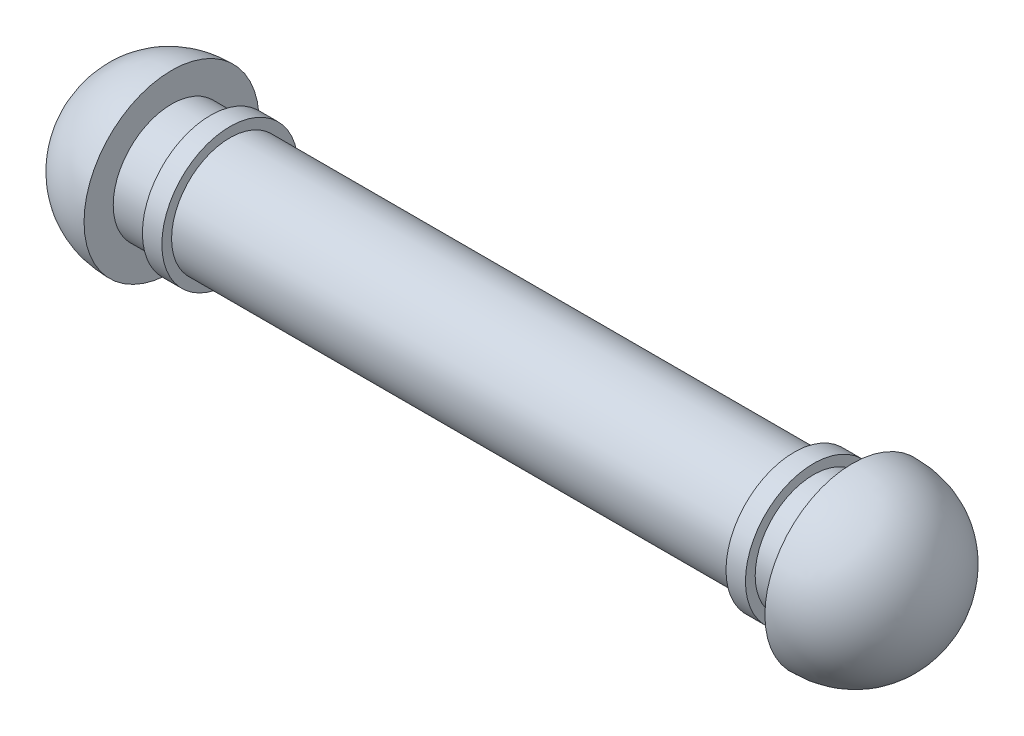
from build123d import *

# Parameters (mm, degrees)
SKETCH1_R           = 30
BOSS_EXTRUDE1_DEPTH = 175
SKETCH3_W           = 10
SKETCH3_H           = 35


with BuildPart() as part:
    # Sketch1 → Boss-Extrude1 (new body)
    with BuildSketch(Plane(origin=(0, 0, 0), x_dir=(0, 0, -1), z_dir=(1, 0, 0))):
        Circle(SKETCH1_R)
    boss_extrude1 = extrude(amount=BOSS_EXTRUDE1_DEPTH)

    # Sketch3 → Revolve1 (revolve)
    with BuildSketch(Plane.XY, mode=Mode.PRIVATE) as revolve1_sk:
        with Locations((25, 17.5)):
            Rectangle(SKETCH3_W, SKETCH3_H)
        with BuildLine():
            Line((0, 0), (-45.458392513, 0))
            add(Edge.make_bspline(
                [(-45.458392513, 0), (-45.458392513, 20.183781855), (-30.991238831, 45), (0, 45)],
                knots=[0, 0, 0, 0, 1, 1, 1, 1], degree=3))
            Line((0, 45), (0, 0))
        make_face()
    revolve1 = revolve(revolve1_sk.sketch.rotate(Axis((-100.078673334, 0, 0), (1, 0, 0)), 90), axis=Axis((-100.078673334, 0, 0), (1, 0, 0)))

    # Mirror1: Boss-Extrude1, Revolve1 across plane
    add(boss_extrude1.mirror(Plane(origin=(175, 0, 0), x_dir=(0, 0, 1), z_dir=(1, 0, 0))))
    add(revolve1.mirror(Plane(origin=(175, 0, 0), x_dir=(0, 0, 1), z_dir=(1, 0, 0))))


solid = part.part
